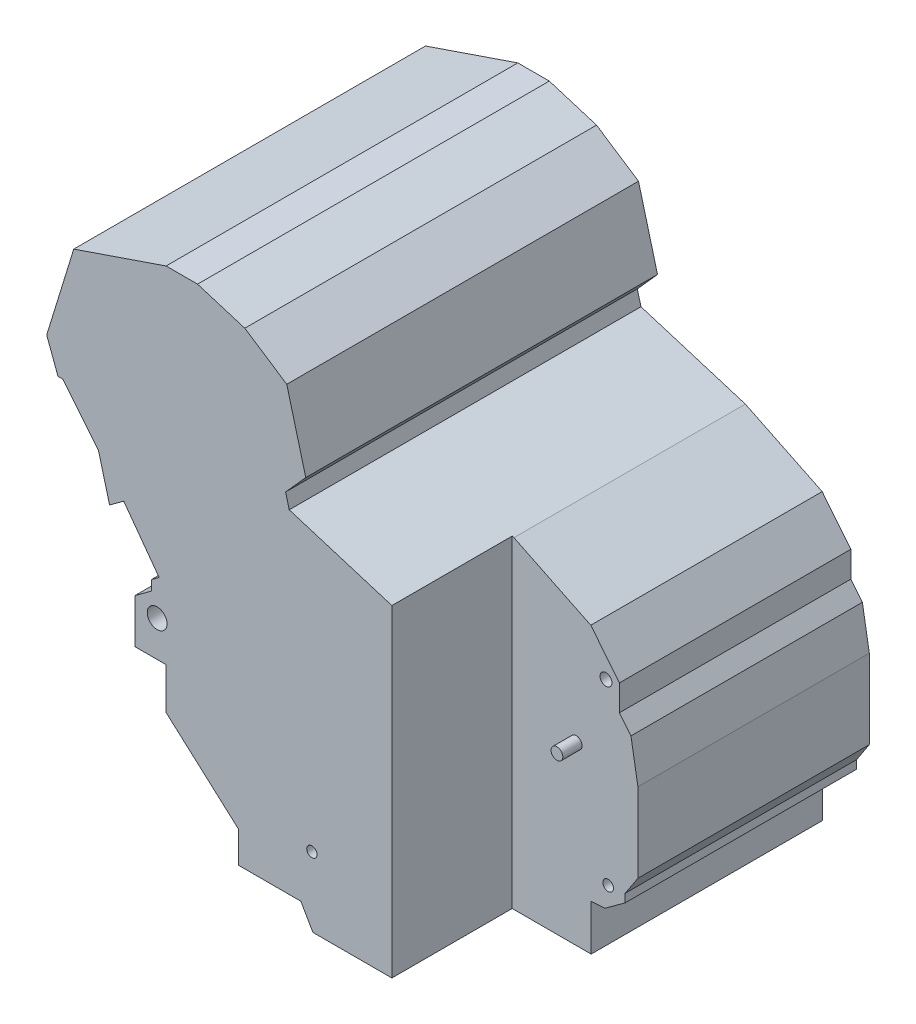
from build123d import *

# Parameters (mm, degrees)
BOSS_EXTRUDE1_DEPTH      = 190
BOSS_EXTRUDE1_DEPTH_BACK = 190
SKETCH1_R                = 10.68990167
SKETCH1_R_2              = 5.55170817
SKETCH1_R_3              = 5.740939067
CUT_EXTRUDE1_DEPTH       = 130
SKETCH3_R                = 6.35
BOSS_EXTRUDE2_DEPTH      = 20.842314


with BuildPart() as part:
    # Sketch1 → Boss-Extrude1 (new, two sides: drawn at the far end of the back side and taken through both)
    with BuildSketch(Plane(origin=(35.496606972, -5.136974217, 0), x_dir=(1, 0, 0), z_dir=(0, 0, 1)).offset(-BOSS_EXTRUDE1_DEPTH_BACK)):
        Polygon((284.999883711, 15.607484417), (298.05126311, -7.040344443), (468.668102698, -7.040344443), (468.668102698, 42.23937617), (483.730976142, 43.43752253), (505.436181993, 59.305899042), (505.436181993, 68.294900601), (519.153293081, 89.155402568), (519.153293081, 174.760868396), (511.650398428, 218.625107166), (499.221965558, 234.051088018), (499.221965558, 262.010224281), (468.239986725, 300.464582706), (385.211765775, 340.848977513), (272.476434341, 375.539814705), (268.552869962, 390.26169862), (290.33684476, 414.625354644), (269.809144882, 491.648791872), (224.483340249, 521.453400518), (173.444905467, 537.158911905), (139.442820163, 537.158911905), (39.692575389, 503.086502617), (10.46069044, 408.091209769), (22.67467758, 375.539814705), (28.02290557, 375.539814705), (66.468894181, 327.821241466), (78.40300996, 283.042400046), (93.703979809, 294.228727981), (131.920372994, 241.955284607), (123.793017705, 236.013487296), (123.793017705, 225.161132619), (105.912703634, 212.089081713), (105.912703634, 164.144657424), (139.442820163, 164.144657424), (139.442820163, 119.380028144), (217.501813233, 49.586104929), (217.501813233, 15.607484417), align=None)
        with Locations((129.793078962, 202.791946132)):
            Circle(SKETCH1_R, mode=Mode.SUBTRACT)
        with Locations((296.941277772, 67.915461322)):
            Circle(SKETCH1_R_2, mode=Mode.SUBTRACT)
        with Locations((487.038630051, 66.43854159)):
            Circle(SKETCH1_R_3, mode=Mode.SUBTRACT)
        with BuildLine():
            ThreePointArc((491.077076188, 257.915461322), (478.307933648, 257.038889769), (490.837506869, 259.652158561))
            ThreePointArc((490.837506869, 259.652158561), (491.016901616, 258.792032876), (491.077076188, 257.915461322))
        make_face(mode=Mode.SUBTRACT)
    extrude(amount=BOSS_EXTRUDE1_DEPTH + BOSS_EXTRUDE1_DEPTH_BACK)

    # Sketch2 → Cut-Extrude1 (cut)
    with BuildSketch(Plane.XY.offset(190)):
        Polygon((418.856289876, -12.17731866), (418.856289876, 350.274106715), (582.658710341, 350.274106715), (582.658710341, -17.845830548), (418.856289876, -17.845830548), align=None)
    extrude(amount=-CUT_EXTRUDE1_DEPTH, mode=Mode.SUBTRACT)

    # Sketch3 → Boss-Extrude2 (add)
    with BuildSketch(Plane.XY.offset(60)):
        with Locations((488.022362989, 177.803201914)):
            Circle(SKETCH3_R)
    extrude(amount=BOSS_EXTRUDE2_DEPTH)


solid = part.part
